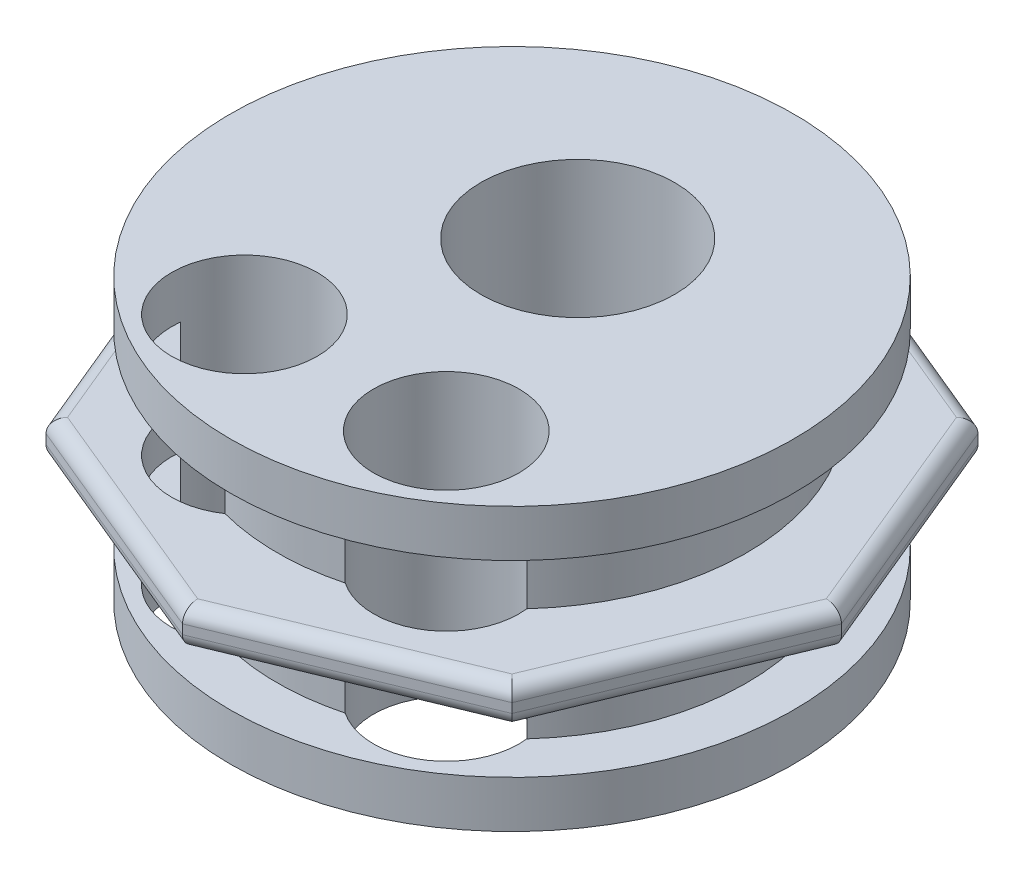
from build123d import *

# Parameters (mm, degrees)
BOSS_EXTRUDE1_DEPTH  = 2
SKETCH12_R           = 25
BOSS_EXTRUDE2_DEPTH  = 8
CUT_EXTRUDE6_START   = -36
SKETCH17_R           = 10.33
CUT_EXTRUDE6_DEPTH   = 45.856111051
SKETCH25_R           = 30
BOSS_EXTRUDE3_DEPTH  = 5
CUT_EXTRUDE9_START   = -53
SKETCH26_R           = 10.33
CUT_EXTRUDE9_DEPTH   = 53
FILLET3_R            = 1.5
SKETCH23_R           = 7.75
CUT_EXTRUDE11_DEPTH  = 36
FILLET3_OF_MIRROR1_R = 1.5
CUT_EXTRUDE12_START  = -10
SKETCH28_R           = 10.33
CUT_EXTRUDE12_DEPTH  = 10


with BuildPart() as part:
    # Sketch3 → Boss-Extrude1 (new body)
    with BuildSketch(Plane(origin=(0, 0, 0), x_dir=(1, 0, 0), z_dir=(0, 1, 0))):
        Polygon((35.1, 0), (24.81944802, 24.81944802), (0, 35.1), (-24.81944802, 24.81944802), (-35.1, 0), (-24.81944802, -24.81944802), (0, -35.1), (24.81944802, -24.81944802), align=None)
    boss_extrude1 = extrude(amount=BOSS_EXTRUDE1_DEPTH)

    # Sketch12 → Boss-Extrude2 (add)
    with BuildSketch(Plane(origin=(0, 2, 0), x_dir=(1, 0, 0), z_dir=(0, 1, 0))):
        Circle(SKETCH12_R)
    boss_extrude2 = extrude(amount=BOSS_EXTRUDE2_DEPTH)

    # Sketch17 → Cut-Extrude6 (cut)
    with BuildSketch(Plane(origin=(0, 10, 0), x_dir=(1, 0, 0), z_dir=(0, 1, 0)).offset(CUT_EXTRUDE6_START)):
        with Locations((0, 7)):
            Circle(SKETCH17_R)
    cut_extrude6 = extrude(amount=CUT_EXTRUDE6_DEPTH, mode=Mode.SUBTRACT)

    # Sketch25 → Boss-Extrude3 (add)
    with BuildSketch(Plane(origin=(0, 10, 0), x_dir=(1, 0, 0), z_dir=(0, 1, 0))):
        Circle(SKETCH25_R)
    boss_extrude3 = extrude(amount=BOSS_EXTRUDE3_DEPTH)

    # Sketch26 → Cut-Extrude9 (cut)
    with BuildSketch(Plane(origin=(0, 15, 0), x_dir=(1, 0, 0), z_dir=(0, 1, 0)).offset(CUT_EXTRUDE9_START)):
        with Locations((0, 7)):
            Circle(SKETCH26_R)
    extrude(amount=CUT_EXTRUDE9_DEPTH, mode=Mode.SUBTRACT)

    # Fillet3
    fillet3_edges = [part.edges().sort_by_distance(p)[0] for p in [
        (12.40972401, 2, 29.95972401),
        (29.95972401, 2, 12.40972401),
        (-12.40972401, 2, 29.95972401),
        (-29.95972401, 2, 12.40972401),
        (-29.95972401, 2, -12.40972401),
        (29.95972401, 2, -12.40972401),
        (-12.40972401, 2, -29.95972401),
        (12.40972401, 2, -29.95972401),
    ]]
    fillet(fillet3_edges, radius=FILLET3_R)

    # Sketch23 → Cut-Extrude11 (cut, symmetric)
    with BuildSketch(Plane(origin=(0, 10, 0), x_dir=(1, 0, 0), z_dir=(0, 1, 0))):
        with Locations((-10.75, -17.75)):
            Circle(SKETCH23_R)
        with Locations((10.75, -17.75)):
            Circle(SKETCH23_R)
    cut_extrude11 = extrude(amount=CUT_EXTRUDE11_DEPTH, both=True, mode=Mode.SUBTRACT)

    # Mirror1: Boss-Extrude1, Boss-Extrude2, Cut-Extrude6, Boss-Extrude3, Cut-Extrude11 across plane
    add(boss_extrude1.mirror(Plane.ZX))
    add(boss_extrude2.mirror(Plane.ZX))
    add(cut_extrude6.mirror(Plane.ZX), mode=Mode.SUBTRACT)
    add(boss_extrude3.mirror(Plane.ZX))
    add(cut_extrude11.mirror(Plane.ZX), mode=Mode.SUBTRACT)

    # Fillet3 of Mirror1
    fillet3_of_mirror1_edges = [part.edges().sort_by_distance(p)[0] for p in [
        (12.40972401, -2, 29.95972401),
        (29.95972401, -2, 12.40972401),
        (-12.40972401, -2, 29.95972401),
        (-29.95972401, -2, 12.40972401),
        (-29.95972401, -2, -12.40972401),
        (29.95972401, -2, -12.40972401),
        (-12.40972401, -2, -29.95972401),
        (12.40972401, -2, -29.95972401),
    ]]
    fillet(fillet3_of_mirror1_edges, radius=FILLET3_OF_MIRROR1_R)

    # Sketch28 → Cut-Extrude12 (cut)
    with BuildSketch(Plane.XZ.offset(15).offset(CUT_EXTRUDE12_START)):
        with Locations((0, -7)):
            Circle(SKETCH28_R)
    extrude(amount=CUT_EXTRUDE12_DEPTH, mode=Mode.SUBTRACT)


solid = part.part
